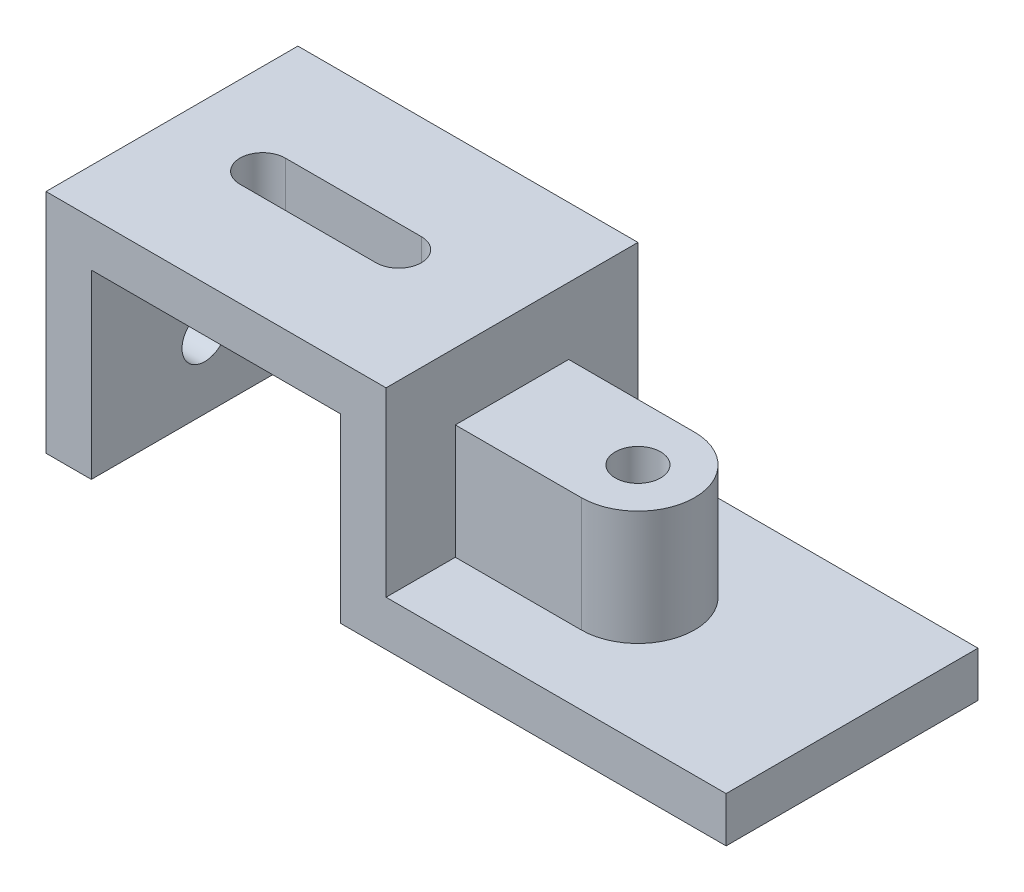
from build123d import *

# Parameters (mm, degrees)
BOSS_EXTRUDE1_DEPTH = 100
CUT_EXTRUDE1_DEPTH  = 100
BOSS_EXTRUDE2_DEPTH = 45.5
HOLE1_D             = 18
HOLE2_D             = 18
HOLE2_DEPTH         = 18


with BuildPart() as part:
    # Sketch1 → Boss-Extrude1 (new body)
    with BuildSketch(Plane.XY):
        Polygon((0, 0), (0, 90), (135, 90), (135, 18), (270, 18), (270, 0), (117, 0), (117, 72), (18, 72), (18, 0), align=None)
    extrude(amount=BOSS_EXTRUDE1_DEPTH)

    # Sketch2 → Cut-Extrude1 (cut)
    with BuildSketch(Plane(origin=(0, 90, 0), x_dir=(1, 0, 0), z_dir=(0, 1, 0))):
        with BuildLine():
            Line((36, -41), (90, -41))
            ThreePointArc((90, -41), (99, -50), (90, -59))
            Line((90, -59), (36, -59))
            ThreePointArc((36, -59), (27, -50), (36, -41))
        make_face()
    extrude(amount=-CUT_EXTRUDE1_DEPTH, mode=Mode.SUBTRACT)

    # Sketch4 → Boss-Extrude2 (add)
    with BuildSketch(Plane(origin=(0, 18, 0), x_dir=(1, 0, 0), z_dir=(0, 1, 0))):
        with BuildLine():
            Line((185, -27.5), (135, -27.5))
            Line((135, -27.5), (135, -72.5))
            Line((135, -72.5), (185, -72.5))
            ThreePointArc((185, -72.5), (207.5, -50), (185, -27.5))
        make_face()
    extrude(amount=BOSS_EXTRUDE2_DEPTH)

    # Hole1 (through all)
    with Locations(Plane(origin=(0, 63.5, 0), x_dir=(1, 0, 0), z_dir=(0, 1, 0))):
        with Locations((185, -50)):
            Hole(HOLE1_D / 2)

    # Hole2
    with Locations(Plane.ZY):
        with Locations((55, 27)):
            Hole(HOLE2_D / 2, depth=HOLE2_DEPTH)


solid = part.part
